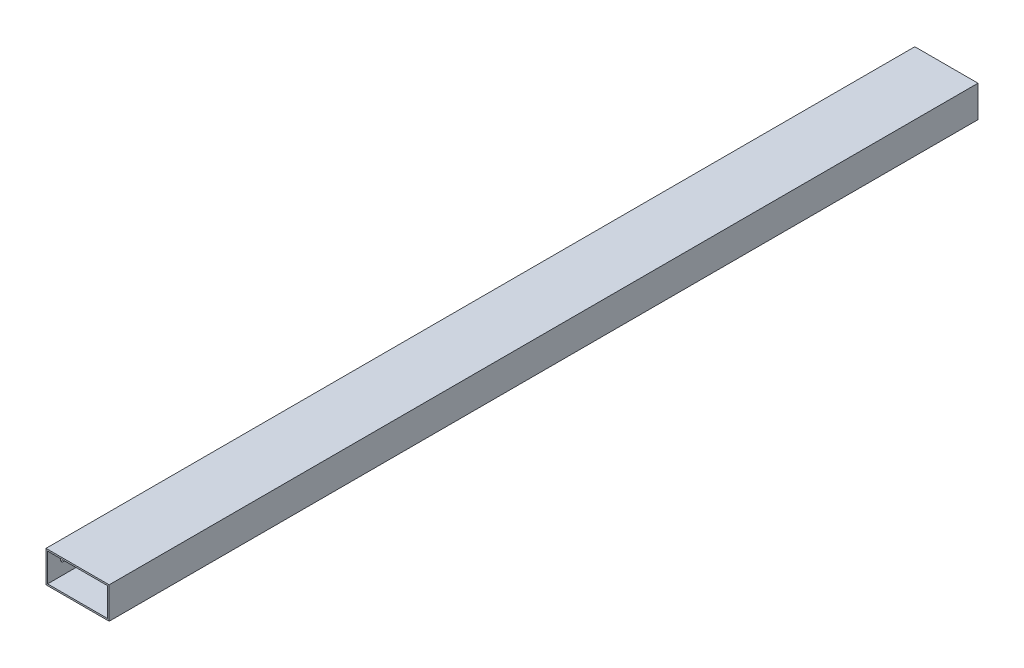
from build123d import *

# Parameters (mm, degrees)
SKETCH_1_W          = 40
SKETCH_1_H          = 20
SKETCH_1_W_2        = 38
SKETCH_1_H_2        = 18
EXTRUDE_1_DEPTH     = 550
SKETCH_4_R          = 1.75
CUT_EXTRUDE_2_DEPTH = 1.5


with BuildPart() as part:
    # 草图1 → 拉伸-薄壁1 (new body)
    with BuildSketch(Plane.XY):
        with Locations((20, -10)):
            Rectangle(SKETCH_1_W, SKETCH_1_H)
        with Locations((20, -10)):
            Rectangle(SKETCH_1_W_2, SKETCH_1_H_2, mode=Mode.SUBTRACT)
    extrude(amount=EXTRUDE_1_DEPTH)

    # 草图4 → 切除-拉伸2 (cut)
    with BuildSketch(Plane.ZY):
        with Locations((539.996387591, -10)):
            Circle(SKETCH_4_R)
        with Locations((10, -10.000000002)):
            Circle(SKETCH_4_R)
    extrude(amount=-CUT_EXTRUDE_2_DEPTH, mode=Mode.SUBTRACT)


solid = part.part
